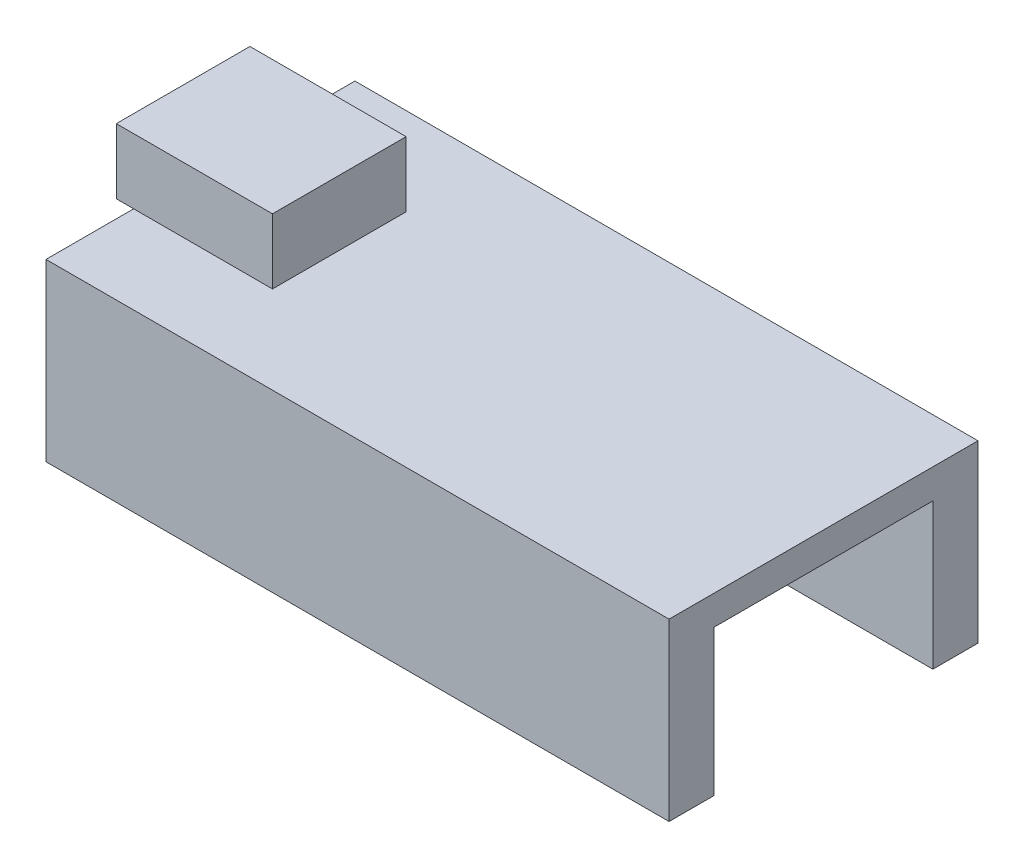
from build123d import *

# Parameters (mm, degrees)
SKETCH1_W      = 35.9
SKETCH1_H      = 17.8
EXTRUDE1_DEPTH = 1.7
SKETCH2_W      = 9
SKETCH2_H      = 7.7
EXTRUDE2_DEPTH = 3.75
SKETCH3_W      = 35.9
SKETCH3_H      = 2.6
EXTRUDE3_DEPTH = 8.4


with BuildPart() as part:
    # Sketch1 → Extrude1 (new body)
    with BuildSketch(Plane(origin=(0, 0, 0), x_dir=(1, 0, 0), z_dir=(0, 1, 0))):
        with Locations((-38.756784273, 20.763622827)):
            Rectangle(SKETCH1_W, SKETCH1_H)
    extrude(amount=EXTRUDE1_DEPTH)

    # Sketch2 → Extrude2 (add)
    with BuildSketch(Plane(origin=(0, 1.7, 0), x_dir=(1, 0, 0), z_dir=(0, 1, 0))):
        with Locations((-53.206784273, 20.763622827)):
            Rectangle(SKETCH2_W, SKETCH2_H)
    extrude(amount=EXTRUDE2_DEPTH)

    # Sketch3 → Extrude3 (add)
    with BuildSketch(Plane.XZ):
        with Locations((-38.756784273, -13.163622827)):
            Rectangle(SKETCH3_W, SKETCH3_H)
        with Locations((-38.756784273, -28.363622827)):
            Rectangle(SKETCH3_W, SKETCH3_H)
    extrude(amount=EXTRUDE3_DEPTH)


solid = part.part
